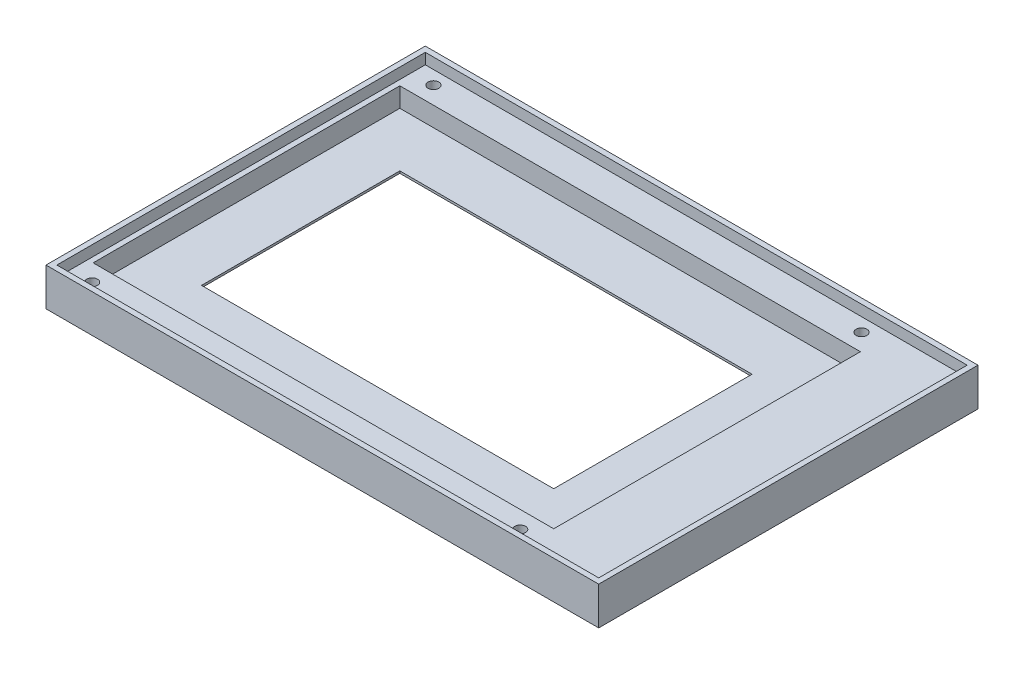
from build123d import *

# Parameters (mm, degrees)
SKETCH_1_W          = 102
SKETCH_1_H          = 70
EXTRUDE_1_DEPTH     = 5
SKETCH_2_W          = 85
SKETCH_2_H          = 56.6
CUT_EXTRUDE_1_DEPTH = 3.6
SKETCH_3_R          = 1
CUT_EXTRUDE_2_DEPTH = 6
SKETCH_5_W          = 100
SKETCH_5_H          = 68
CUT_EXTRUDE_4_DEPTH = 1
SKETCH_6_W          = 7
SKETCH_6_H          = 1
CUT_EXTRUDE_5_DEPTH = 1
SKETCH_7_W          = 65
SKETCH_7_H          = 36.6
CUT_EXTRUDE_6_DEPTH = 10
SKETCH_8_W          = 102
SKETCH_8_H          = 70
SKETCH_8_W_2        = 100
SKETCH_8_H_2        = 68
EXTRUDE_2_DEPTH     = 2


with BuildPart() as part:
    # Эскиз1 → Бобышка-Вытянуть1 (new body)
    with BuildSketch(Plane(origin=(0, 0, 0), x_dir=(1, 0, 0), z_dir=(0, 1, 0))):
        Rectangle(SKETCH_1_W, SKETCH_1_H)
    extrude(amount=EXTRUDE_1_DEPTH)

    # Эскиз2 → Вырез-Вытянуть1 (cut)
    with BuildSketch(Plane(origin=(0, 5, 0), x_dir=(1, 0, 0), z_dir=(0, 1, 0))):
        with Locations((-6.5, 0)):
            Rectangle(SKETCH_2_W, SKETCH_2_H)
    extrude(amount=-CUT_EXTRUDE_1_DEPTH, mode=Mode.SUBTRACT)

    # Эскиз3 → Вырез-Вытянуть2 (cut)
    with BuildSketch(Plane(origin=(0, 5, 0), x_dir=(1, 0, 0), z_dir=(0, 1, 0))):
        with Locations(Location((33, -31.5, 0), (0, 0, 270))):
            Circle(SKETCH_3_R)
        with Locations(Location((33, 31.5, 0), (0, 0, 270))):
            Circle(SKETCH_3_R)
        with Locations(Location((-46, -31.5, 0), (0, 0, 270))):
            Circle(SKETCH_3_R)
        with Locations(Location((-46, 31.5, 0), (0, 0, 270))):
            Circle(SKETCH_3_R)
    extrude(amount=-CUT_EXTRUDE_2_DEPTH, mode=Mode.SUBTRACT)

    # Эскиз5 → Вырез-Вытянуть4 (cut)
    with BuildSketch(Plane.XZ):
        Rectangle(SKETCH_5_W, SKETCH_5_H)
    extrude(amount=-CUT_EXTRUDE_4_DEPTH, mode=Mode.SUBTRACT)

    # Эскиз6 → Вырез-Вытянуть5 (cut)
    with BuildSketch(Plane.ZY.offset(51)):
        with Locations((0, 0.5)):
            Rectangle(SKETCH_6_W, SKETCH_6_H)
    extrude(amount=-CUT_EXTRUDE_5_DEPTH, mode=Mode.SUBTRACT)

    # Эскиз7 → Вырез-Вытянуть6 (cut)
    with BuildSketch(Plane(origin=(0, 1.4, 0), x_dir=(1, 0, 0), z_dir=(0, 1, 0))):
        with Locations((-6.5, 0)):
            Rectangle(SKETCH_7_W, SKETCH_7_H)
    extrude(amount=-CUT_EXTRUDE_6_DEPTH, mode=Mode.SUBTRACT)

    # Эскиз8 → Бобышка-Вытянуть2 (add)
    with BuildSketch(Plane(origin=(0, 5, 0), x_dir=(1, 0, 0), z_dir=(0, 1, 0))):
        Rectangle(SKETCH_8_W, SKETCH_8_H)
        Rectangle(SKETCH_8_W_2, SKETCH_8_H_2, mode=Mode.SUBTRACT)
    extrude(amount=EXTRUDE_2_DEPTH)


solid = part.part
